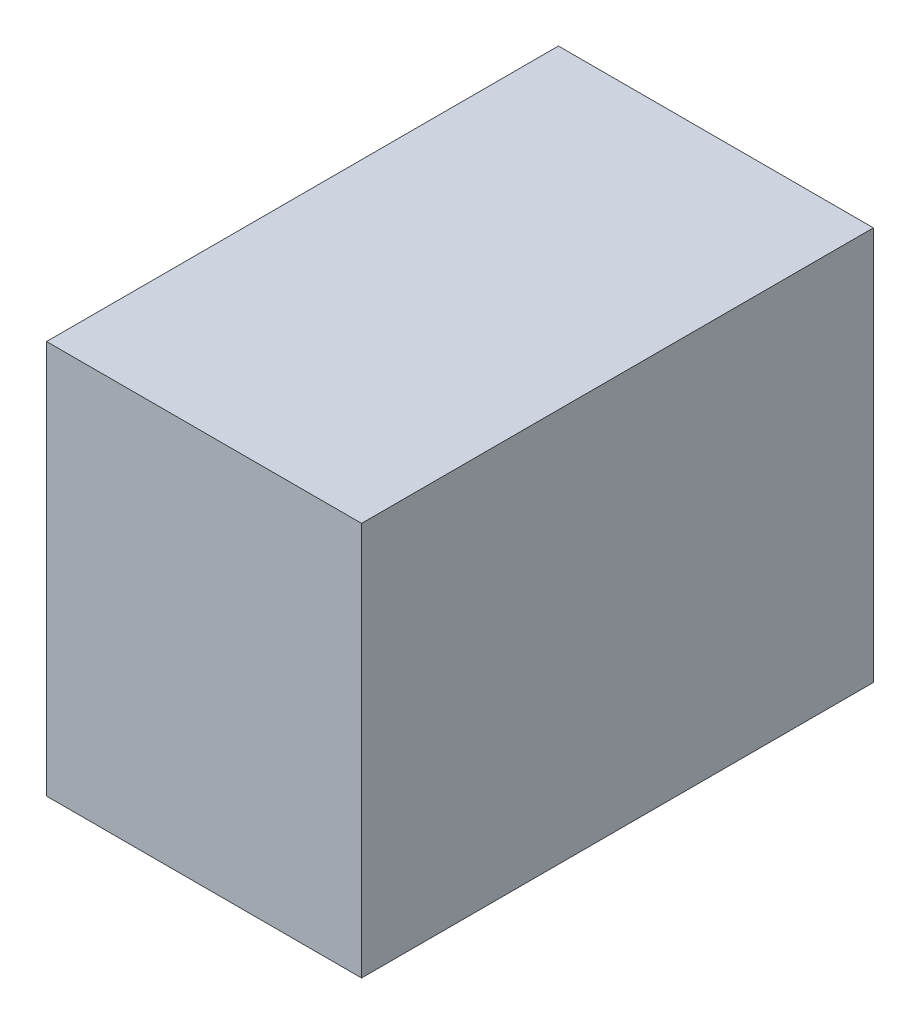
from build123d import *

# Parameters (mm, degrees)
ESBO_O1_W                = 80
ESBO_O1_H                = 100
RESSALTO_EXTRUS_O1_DEPTH = 130


with BuildPart() as part:
    # Esboço1 → Ressalto-extrusão1 (new body)
    with BuildSketch(Plane.XY):
        with Locations((40, 50)):
            Rectangle(ESBO_O1_W, ESBO_O1_H)
    extrude(amount=RESSALTO_EXTRUS_O1_DEPTH)


solid = part.part
